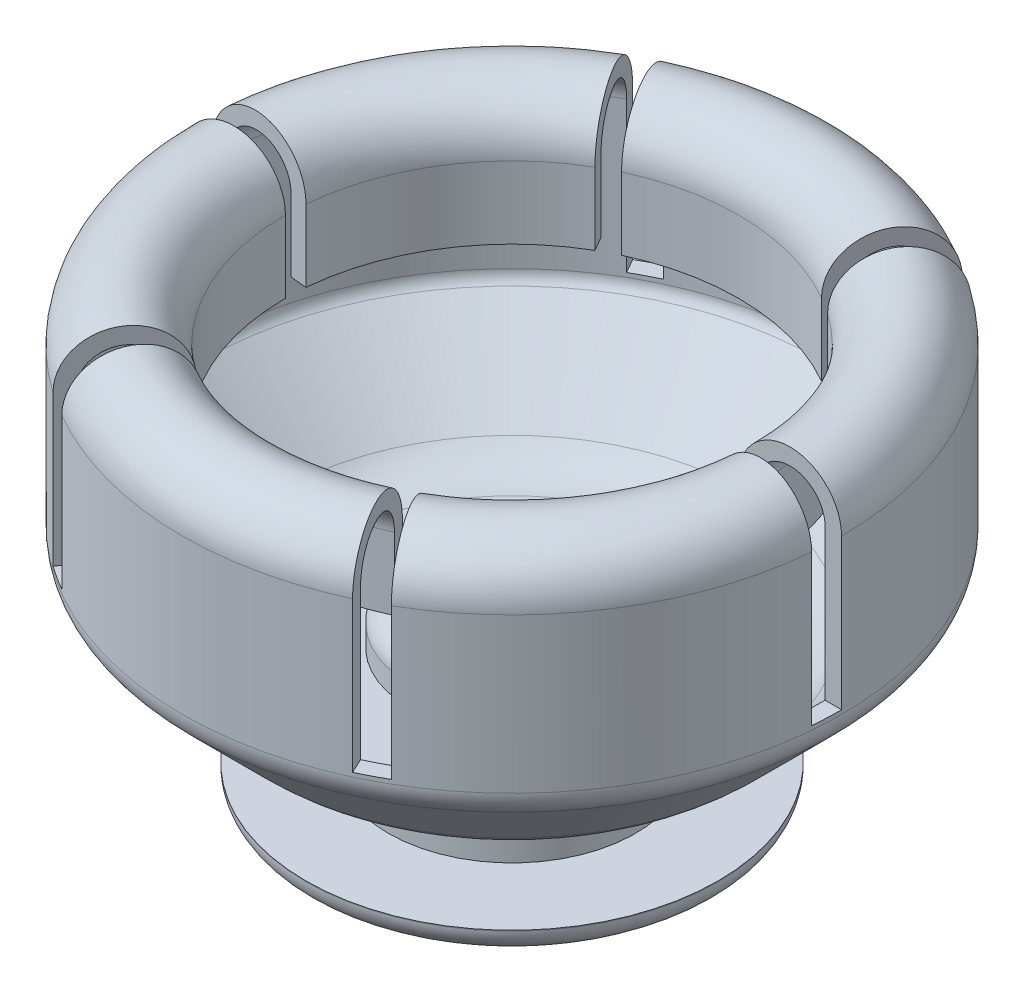
from build123d import *
from build123d.topology import SkipClean

# Parameters (mm, degrees)
R_VOLUTION2_ANGLE            = 55
R_P_TITION_CIRCULAIRE1_COUNT = 6


with BuildPart() as part:
    # Esquisse1 → Révolution1 (revolve)
    with BuildSketch(Plane.XY, mode=Mode.PRIVATE) as r_volution1_sk:
        with BuildLine():
            Line((0, 0), (0, 0.3))
            Line((0, 0.3), (0.01, 0.3))
            ThreePointArc((0.01, 0.3), (0.116066017, 0.343933983), (0.16, 0.45))
            Line((0.16, 0.45), (0.16, 0.46))
            ThreePointArc((0.16, 0.46), (0.233223305, 0.636776695), (0.41, 0.71))
            Line((0.41, 0.71), (1.00614476, 0.71))
            ThreePointArc((1.00614476, 0.71), (1.182921455, 0.636776695), (1.25614476, 0.46))
            Line((1.25614476, 0.46), (1.25614476, 0.204672897))
            Line((1.25614476, 0.204672897), (2.25614476, 0.204672897))
            ThreePointArc((2.25614476, 0.204672897), (2.562291506, 0.265569271), (2.821830185, 0.438987472))
            Line((2.821830185, 0.438987472), (3.741421356, 1.358578644))
            ThreePointArc((3.741421356, 1.358578644), (3.784775907, 1.423463314), (3.8, 1.5))
            Line((3.8, 1.5), (3.8, 1.55))
            Line((3.8, 1.55), (4, 1.55))
            Line((4, 1.55), (4, 1.5))
            ThreePointArc((4, 1.5), (3.969551813, 1.346926627), (3.882842712, 1.217157288))
            Line((3.882842712, 1.217157288), (2.958578644, 0.292893219))
            ThreePointArc((2.958578644, 0.292893219), (2.634155295, 0.076120467), (2.251471863, 0))
            Line((2.251471863, 0), (1.5, 0))
            Line((1.5, 0), (1.5, -1))
            Line((1.5, -1), (2.5, -1))
            Line((2.5, -1), (2.5, -1.01))
            ThreePointArc((2.5, -1.01), (2.412132034, -1.222132034), (2.2, -1.31))
            Line((2.2, -1.31), (0.2, -1.31))
            ThreePointArc((0.2, -1.31), (0.141421356, -1.168578644), (0, -1.11))
            Line((0, -1.11), (0, 0))
        make_face()
    revolve(r_volution1_sk.sketch.rotate(Axis((0, 1.645794393, 0), (0, -1, 0)), 90), axis=Axis((0, 1.645794393, 0), (0, -1, 0)))

    # Esquisse2 → Révolution2 (revolve)
    with BuildSketch(Plane.XY):
        with BuildLine():
            Line((4, 1.55), (4, 3.375))
            ThreePointArc((4, 3.375), (3.375, 4), (2.75, 3.375))
            Line((2.75, 3.375), (2.75, 2.5))
            Line((2.75, 2.5), (2.95, 2.5))
            Line((2.95, 2.5), (2.95, 3.375))
            ThreePointArc((2.95, 3.375), (3.375, 3.8), (3.8, 3.375))
            Line((3.8, 3.375), (3.8, 1.55))
            Line((3.8, 1.55), (4, 1.55))
        make_face()
    r_volution2 = revolve(axis=Axis((0, -1.596636686, 0), (0, 1, 0)), revolution_arc=R_VOLUTION2_ANGLE)

    # Répétition circulaire1: Révolution2 ×6 about axis
    with SkipClean():  # the faces are left unmerged after this step: merging them gives an invalid solid
        r_p_tition_circulaire1_axis = Axis((0, 0, 0), (0, 1, 0))
        for i in range(1, R_P_TITION_CIRCULAIRE1_COUNT):
            add(r_volution2.rotate(r_p_tition_circulaire1_axis, i * 360 / R_P_TITION_CIRCULAIRE1_COUNT))


solid = part.part
